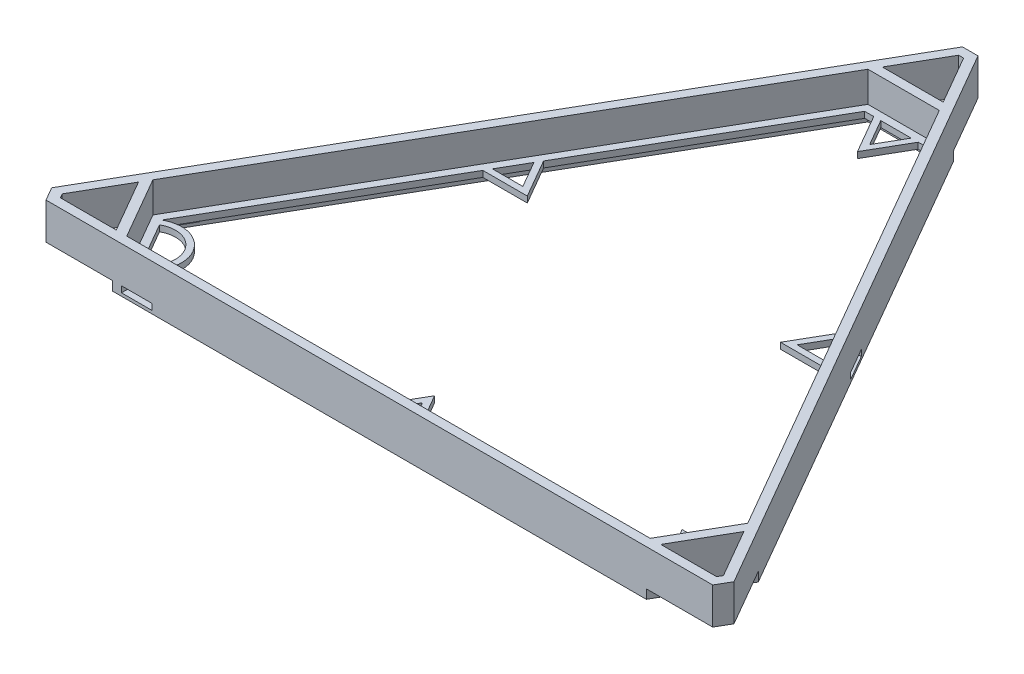
from build123d import *

# Parameters (mm, degrees)
BOSS_EXTRUDE1_DEPTH = 12
BOSS_EXTRUDE2_DEPTH = 2
BOSS_EXTRUDE3_DEPTH = 3
SKETCH4_W           = 10
SKETCH4_H           = 2
CUT_EXTRUDE1_DEPTH  = 6
SKETCH5_W           = 10
SKETCH5_H           = 2
CUT_EXTRUDE2_DEPTH  = 6
SKETCH6_W           = 10
SKETCH6_H           = 2
CUT_EXTRUDE3_DEPTH  = 6


with BuildPart() as part:
    # Sketch1 → Boss-Extrude1 (new body)
    with BuildSketch(Plane(origin=(0, 0, 0), x_dir=(1, 0, 0), z_dir=(0, 1, 0))):
        Polygon((109.556624327, -4.42820323), (-109.556624327, -4.42820323), (-112.113248654, 0), (-2.55662435, 189.757639654), (2.556624303, 189.757639654), (112.113248654, 0), align=None)
        Polygon((-107.82457352, -1.42820323), (-108.649147039, 0), (-99.473720558, 15.892304845), (-89.473720559, -1.42820323), align=None, mode=Mode.SUBTRACT)
        Polygon((-0.824573543, 186.757639627), (0.824573481, 186.757639627), (9.999999979, 170.86533478), (-10.000000021, 170.86533478), align=None, mode=Mode.SUBTRACT)
        Polygon((108.649147039, 0), (107.82457353, -1.428203222), (89.473720569, -1.428203222), (99.473720569, 15.892304853), align=None, mode=Mode.SUBTRACT)
        Polygon((-11.732050803, 167.865334802), (11.732050803, 167.865334802), (97.741669765, 18.89230486), (86.00961895, -1.428203229), (-86.009618944, -1.428203229), (-97.741669751, 18.892304845), align=None, mode=Mode.SUBTRACT)
    extrude(amount=BOSS_EXTRUDE1_DEPTH)

    # Sketch1<4> → Boss-Extrude2 (add)
    with BuildSketch(Plane(origin=(0, 0, 0), x_dir=(1, 0, 0), z_dir=(0, 1, 0))):
        Polygon((11.732050803, 167.865334802), (-11.732050803, 167.865334802), (-97.741669751, 18.892304845), (-86.009618944, -1.428203229), (86.00961895, -1.428203229), (97.741669765, 18.89230486), align=None)
        with BuildLine():
            Line((-85.566243251, 2.803847594), (-93.854918378, 17.160254041))
            ThreePointArc((-93.854918378, 17.160254041), (-82.532377591, 14.126388381), (-85.566243251, 2.803847594))
        make_face(mode=Mode.SUBTRACT)
        Polygon((-1e-08, 9.732050841), (4.99999999, 1.071796803), (-5.00000001, 1.071796803), align=None, mode=Mode.SUBTRACT)
        Polygon((-45.071796745, 87.798692801), (-55.071796745, 87.798692801), (-50.071796745, 96.458946839), align=None, mode=Mode.SUBTRACT)
        Polygon((82.210580848, 14.312177834), (92.210580848, 14.312177834), (87.210580848, 5.651923796), align=None, mode=Mode.SUBTRACT)
        with BuildLine():
            Line((48.91709624, 98.458946834), (41.607695163, 85.798692796))
            Line((41.607695163, 85.798692796), (56.226497316, 85.798692796))
            Line((56.226497316, 85.798692796), (94.854918412, 18.892304841))
            Line((94.854918412, 18.892304841), (93.36528139, 16.312177834))
            Line((93.36528139, 16.312177834), (78.746479233, 16.312177834))
            Line((78.746479233, 16.312177834), (86.055880312, 3.651923793))
            Line((86.055880312, 3.651923793), (84.566243293, 1.071796793))
            Line((84.566243293, 1.071796793), (7.309401088, 1.071796793))
            Line((7.309401088, 1.071796793), (2e-09, 13.732050847))
            Line((2e-09, 13.732050847), (-7.309401077, 1.071796786))
            Line((-7.309401077, 1.071796786), (-84.566243251, 1.071796786))
            ThreePointArc((-84.566243251, 1.071796786), (-80.800326783, 15.126388381), (-94.854918378, 18.892304849))
            Line((-94.854918378, 18.892304849), (-56.226497283, 85.798692801))
            Line((-56.226497283, 85.798692801), (-41.60769513, 85.798692801))
            Line((-41.60769513, 85.798692801), (-48.917096207, 98.458946839))
            Line((-48.917096207, 98.458946839), (-10.288675112, 165.365334792))
            Line((-10.288675112, 165.365334792), (-7.309401077, 165.365334792))
            Line((-7.309401077, 165.365334792), (0, 152.705080754))
            Line((0, 152.705080754), (7.309401077, 165.365334792))
            Line((7.309401077, 165.365334792), (10.288675142, 165.365334792))
            Line((10.288675142, 165.365334792), (48.91709624, 98.458946834))
        make_face(mode=Mode.SUBTRACT)
        Polygon((45.071796778, 87.798692803), (50.071796778, 96.458946841), (55.071796778, 87.798692803), align=None, mode=Mode.SUBTRACT)
        Polygon((0, 156.705080761), (-5, 165.365334799), (5, 165.365334799), align=None, mode=Mode.SUBTRACT)
    extrude(amount=BOSS_EXTRUDE2_DEPTH)

    # Sketch2 → Boss-Extrude3 (add)
    with BuildSketch(Plane.XZ):
        Polygon((101.205771363, -18.892304847), (87.741669751, 4.42820323), (-87.741669751, 4.42820323), (-101.205771368, -18.892304847), (-13.464101652, -170.86533478), (13.464101609, -170.86533478), align=None)
        Polygon((-11.732050819, -167.865334802), (11.732050795, -167.865334802), (97.741669739, -18.892304852), (86.009618931, 1.42820323), (-86.009618931, 1.42820323), (-97.741669763, -18.892304852), align=None, mode=Mode.SUBTRACT)
    extrude(amount=BOSS_EXTRUDE3_DEPTH)

    # Sketch4 → Cut-Extrude1 (cut)
    with BuildSketch(Plane.XY.offset(4.42820323)):
        with Locations((-79.741669751, -1)):
            Rectangle(SKETCH4_W, SKETCH4_H)
    extrude(amount=-CUT_EXTRUDE1_DEPTH, mode=Mode.SUBTRACT)

    # Sketch5 → Cut-Extrude2 (cut)
    with BuildSketch(Plane(origin=(-84.084936503, 0, -48.546460711), x_dir=(-0.4999999998935114, 0, 0.86602540384592), z_dir=(-0.86602540384592, 0, -0.4999999998935114))):
        with Locations((26.241669739, -1)):
            Rectangle(SKETCH5_W, SKETCH5_H)
    extrude(amount=-CUT_EXTRUDE2_DEPTH, mode=Mode.SUBTRACT)

    # Sketch6 → Cut-Extrude3 (cut)
    with BuildSketch(Plane(origin=(84.084936484, 0, -48.546460721), x_dir=(-0.5000000000540236, 0, -0.8660254037532481), z_dir=(0.8660254037532481, 0, -0.5000000000540236))):
        with Locations((53.499999991, -1)):
            Rectangle(SKETCH6_W, SKETCH6_H)
    extrude(amount=-CUT_EXTRUDE3_DEPTH, mode=Mode.SUBTRACT)


solid = part.part
